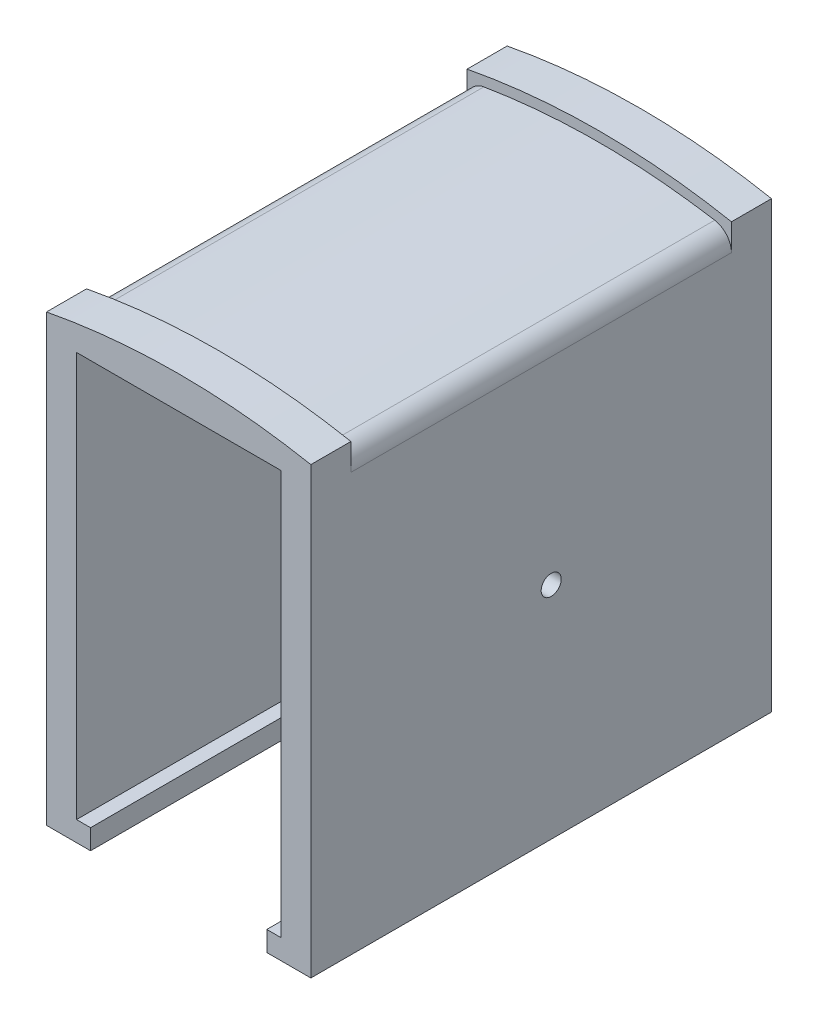
from build123d import *

# Parameters (mm, degrees)
BOSS_EXTRUDE1_DEPTH = 25.4
BOSS_EXTRUDE2_DEPTH = 5.08
LPATTERN1_COUNT     = 2
LPATTERN1_PITCH     = 53.34
FILLET7_R           = 2.54
SKETCH4_R           = 1.27
CUT_EXTRUDE1_DEPTH  = 71.375878595


with BuildPart() as part:
    # Sketch1 → Boss-Extrude1 (new, symmetric)
    with BuildSketch(Plane.XY):
        with BuildLine():
            Line((-12.954, 0), (12.954, 0))
            Line((12.954, 0), (12.954, -51.308))
            Line((12.954, -51.308), (11.176, -51.308))
            Line((11.176, -51.308), (11.176, -53.848))
            Line((11.176, -53.848), (16.764, -53.848))
            Line((16.764, -53.848), (16.764, 1.27))
            ThreePointArc((16.764, 1.27), (0, 2.864912496), (-16.764, 1.27))
            Line((-16.764, 1.27), (-16.764, -53.848))
            Line((-16.764, -53.848), (-11.176, -53.848))
            Line((-11.176, -53.848), (-11.176, -51.308))
            Line((-11.176, -51.308), (-12.954, -51.308))
            Line((-12.954, -51.308), (-12.954, 0))
        make_face()
    extrude(amount=BOSS_EXTRUDE1_DEPTH, both=True)

    # Sketch2 → Boss-Extrude2 (add)
    with BuildSketch(Plane.XY.offset(25.4)):
        with BuildLine():
            Line((16.764, -53.848), (16.764, 2.54))
            ThreePointArc((16.764, 2.54), (0, 4.134912496), (-16.764, 2.54))
            Line((-16.764, 2.54), (-16.764, -53.848))
            Line((-16.764, -53.848), (-11.176, -53.848))
            Line((-11.176, -53.848), (-11.176, -51.308))
            Line((-11.176, -51.308), (-12.954, -51.308))
            Line((-12.954, -51.308), (-12.954, 0))
            Line((-12.954, 0), (12.954, 0))
            Line((12.954, 0), (12.954, -51.308))
            Line((12.954, -51.308), (11.176, -51.308))
            Line((11.176, -51.308), (11.176, -53.848))
            Line((11.176, -53.848), (16.764, -53.848))
        make_face()
    boss_extrude2 = extrude(amount=BOSS_EXTRUDE2_DEPTH)

    # LPattern1: Boss-Extrude2 ×2
    with Locations(*[(0, 0, -i * LPATTERN1_PITCH) for i in range(1, LPATTERN1_COUNT)]):
        add(boss_extrude2)

    # Fillet7
    fillet7_edges = [part.edges().sort_by_distance(p)[0] for p in [
        (-16.764, 1.27, 1.27),
        (16.764, 1.27, 1.27),
    ]]
    fillet(fillet7_edges, radius=FILLET7_R)

    # Sketch4 → Cut-Extrude1 (cut, through all)
    with BuildSketch(Plane.ZY.offset(16.764)):
        with Locations((0, -25.908)):
            Circle(SKETCH4_R)
    extrude(amount=-CUT_EXTRUDE1_DEPTH, mode=Mode.SUBTRACT)


solid = part.part
